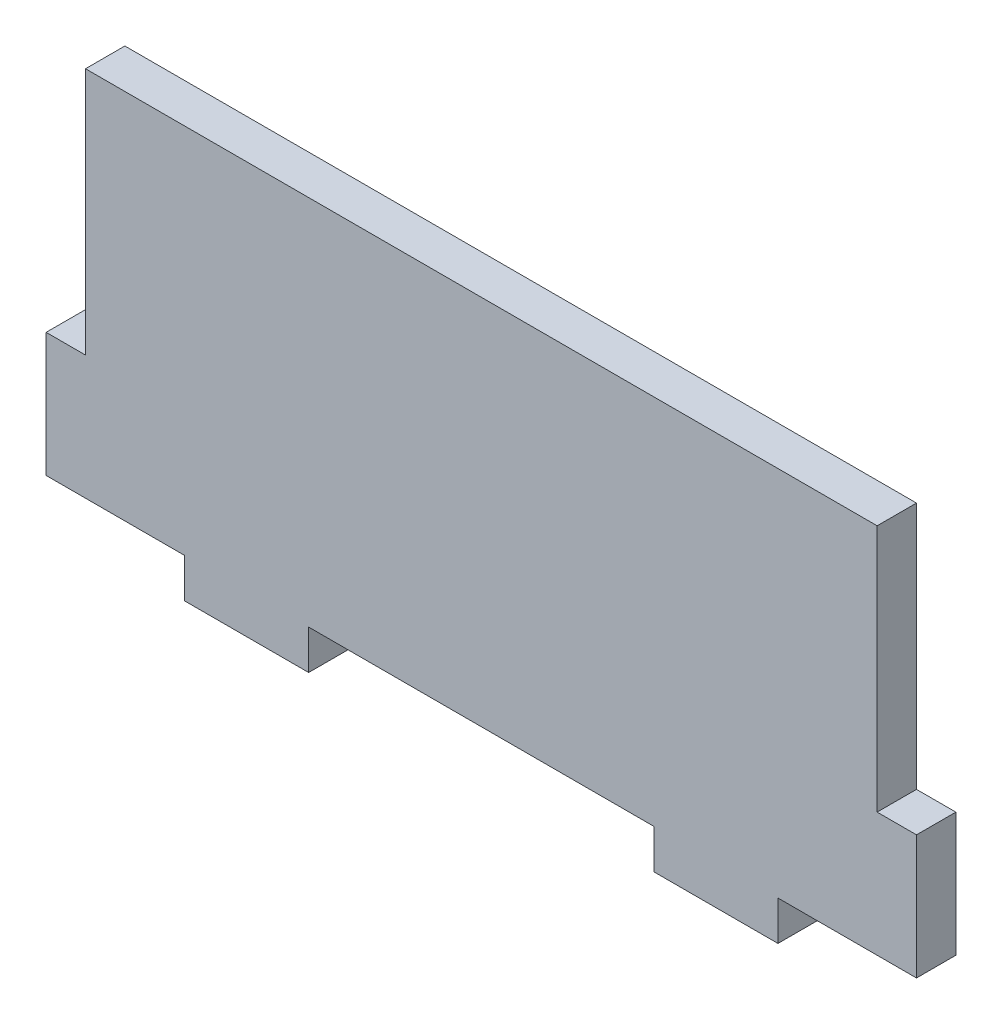
from build123d import *

# Parameters (mm, degrees)
SKETCH3_W           = 255.4
SKETCH3_H           = 120
SKETCH3_W_2         = 12.7
SKETCH3_H_2         = 40
SKETCH3_W_3         = 40
SKETCH3_H_3         = 12.7
BOSS_EXTRUDE1_DEPTH = 12.7


with BuildPart() as part:
    # Sketch3 → Boss-Extrude1 (new body)
    with BuildSketch(Plane.XY):
        Rectangle(SKETCH3_W, SKETCH3_H)
        with Locations((-134.05, -40)):
            Rectangle(SKETCH3_W_2, SKETCH3_H_2)
        with Locations((-75.7, -66.35)):
            Rectangle(SKETCH3_W_3, SKETCH3_H_3)
        with Locations((75.7, -66.35)):
            Rectangle(SKETCH3_W_3, SKETCH3_H_3)
        with Locations((134.05, -40)):
            Rectangle(SKETCH3_W_2, SKETCH3_H_2)
    extrude(amount=BOSS_EXTRUDE1_DEPTH)


solid = part.part
